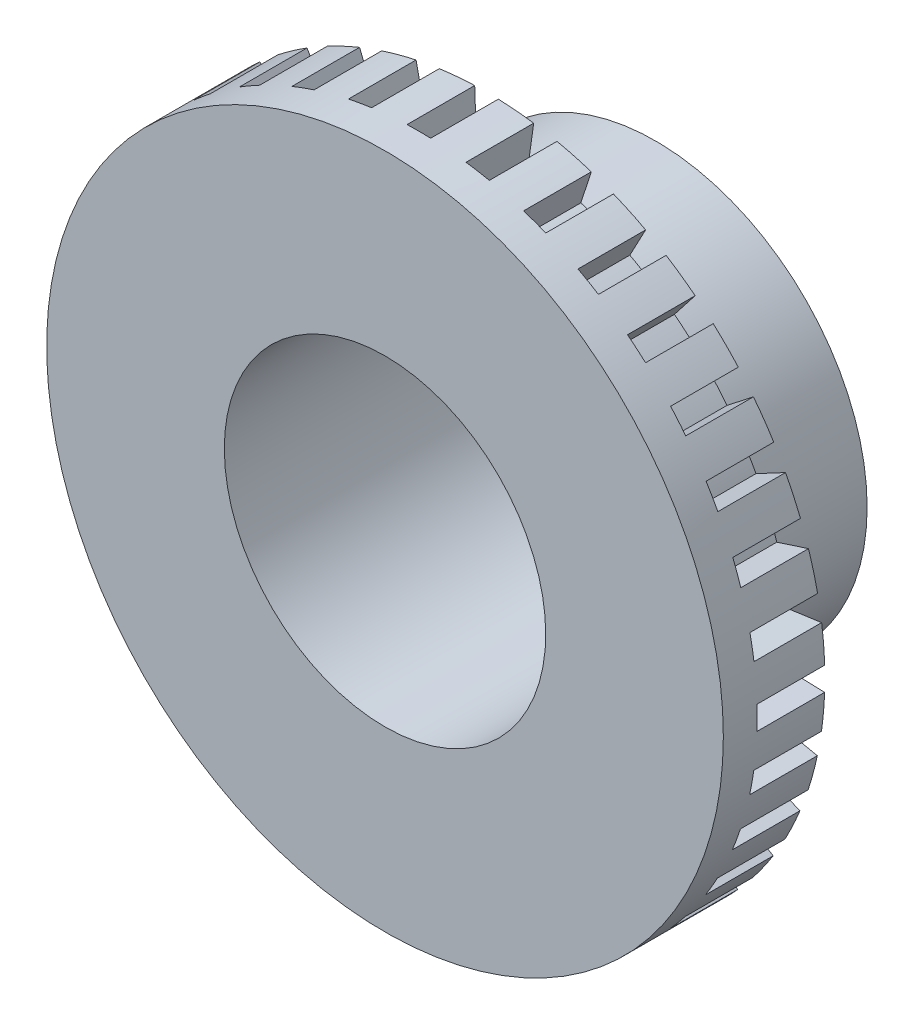
from build123d import *

# Parameters (mm, degrees)
SKETCH1_R                = 20
BOSS_EXTRUDE1_DEPTH      = 4
CUT_EXTRUDE1_DEPTH       = 4.5
CIRPATTERN2_COUNT        = 36
SKETCH1_4_R              = 9.5
CUT_EXTRUDE2_DEPTH       = 10
BOSS_EXTRUDE2_START      = -10
SKETCH1_5_R              = 12.5
SKETCH1_5_R_2            = 9.5
BOSS_EXTRUDE2_DEPTH      = 10
BOSS_EXTRUDE3_DEPTH      = 4
BOSS_EXTRUDE3_DEPTH_BACK = 10
SKETCH3_R                = 20
SKETCH3_R_2              = 9.5
BOSS_EXTRUDE6_DEPTH      = 2


with BuildPart() as part:
    # Sketch1 → Boss-Extrude1 (new body)
    with BuildSketch(Plane.XY):
        Circle(SKETCH1_R)
    extrude(amount=BOSS_EXTRUDE1_DEPTH)

    # Sketch1<3> → Cut-Extrude1 (cut)
    with BuildSketch(Plane.XY):
        with BuildLine():
            ThreePointArc((-0.628190941, 17.989034886), (0, 18), (0.628190941, 17.989034886))
            Line((0.628190941, 17.989034886), (0.697989934, 19.98781654))
            ThreePointArc((0.697989934, 19.98781654), (0, 20), (-0.697989934, 19.98781654))
            Line((-0.697989934, 19.98781654), (-0.628190941, 17.989034886))
        make_face()
    cut_extrude1 = extrude(amount=CUT_EXTRUDE1_DEPTH, mode=Mode.SUBTRACT)

    # CirPattern2: Cut-Extrude1 ×36 about axis
    cirpattern2_axis = Axis((0, -0.040224915, 0), (0, 0, 1))
    for i in range(1, CIRPATTERN2_COUNT):
        add(cut_extrude1.rotate(cirpattern2_axis, i * 360 / CIRPATTERN2_COUNT), mode=Mode.SUBTRACT)

    # Sketch1<4> → Cut-Extrude2 (cut)
    with BuildSketch(Plane.XY):
        Circle(SKETCH1_4_R)
    extrude(amount=CUT_EXTRUDE2_DEPTH, mode=Mode.SUBTRACT)

    # Sketch1<5> → Boss-Extrude2 (add)
    with BuildSketch(Plane.XY.offset(BOSS_EXTRUDE2_START)):
        Circle(SKETCH1_5_R)
        Circle(SKETCH1_5_R_2, mode=Mode.SUBTRACT)
    extrude(amount=BOSS_EXTRUDE2_DEPTH)

    # Sketch1<6> → Boss-Extrude3 (add, two sides: drawn at the far end of the back side and taken through both)
    with BuildSketch(Plane.XY.offset(-BOSS_EXTRUDE3_DEPTH_BACK)):
        with BuildLine():
            Line((9.463849632, 0.827979556), (7.471460236, 0.653668071))
            ThreePointArc((7.471460236, 0.653668071), (7.5, 0), (7.471460236, -0.653668071))
            Line((7.471460236, -0.653668071), (9.463849632, -0.827979556))
            ThreePointArc((9.463849632, -0.827979556), (9.490958105, -0.41438418), (9.5, 0))
            ThreePointArc((9.5, 0), (9.490958105, 0.41438418), (9.463849632, 0.827979556))
        make_face()
    extrude(amount=BOSS_EXTRUDE3_DEPTH + BOSS_EXTRUDE3_DEPTH_BACK)

    # Sketch3 → Boss-Extrude6 (add)
    with BuildSketch(Plane.XY.offset(4)):
        with Locations(Location((0, 0, 0), (0, 0, 178.119187454))):
            Circle(SKETCH3_R)
        with Locations(Location((0, 0, 0), (0, 0, 355))):
            Circle(SKETCH3_R_2, mode=Mode.SUBTRACT)
    extrude(amount=BOSS_EXTRUDE6_DEPTH)


solid = part.part
